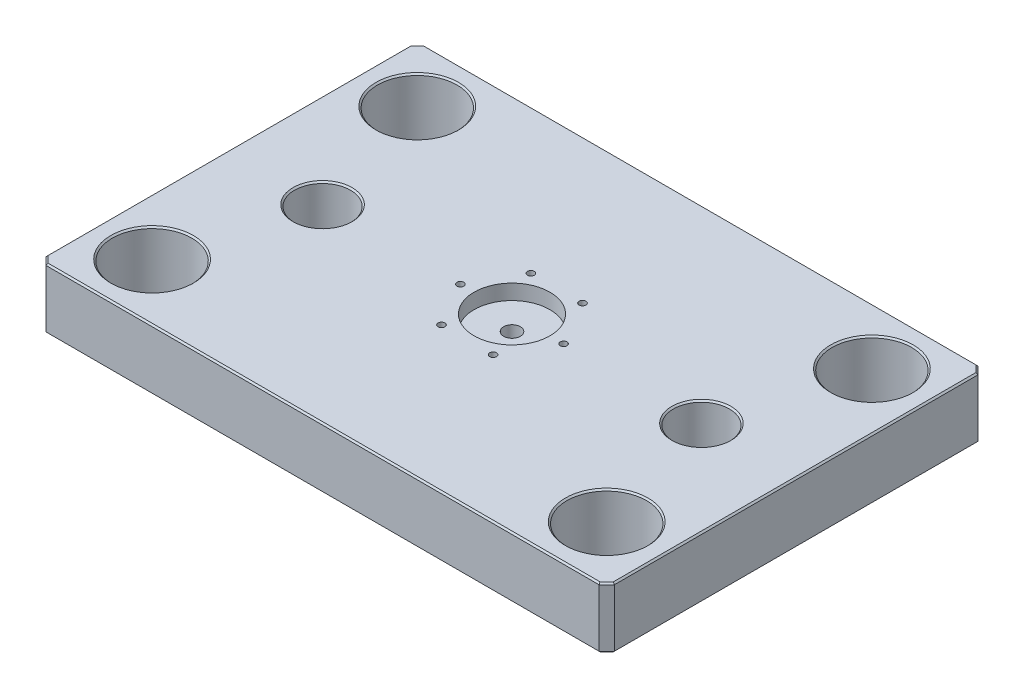
from build123d import *

# Parameters (mm, degrees)
SZKIC1_W                                            = 750
SZKIC1_H                                            = 500
WYCI_GNI_CIE1_DEPTH                                 = 80
SFAZOWANIE1_SIZE                                    = 10
WYCI_GNI_CIE2_REACH                                 = 459.739
SZKIC2_R                                            = 52.5
WYCI_GNI_CIE3_REACH                                 = 459.739
SZKIC3_R                                            = 37
SFAZOWANIE2_SIZE                                    = 2
WYTNIJ_WYCI_GNI_CIE1_DEPTH                          = 0.1
SZKIC5_R                                            = 50
WYTNIJ_WYCI_GNI_CIE3_DEPTH                          = 20
POG_BIENIE_WALCOWE_POD_M8_WKR_T_Z_BEM_W_D           = 9
POG_BIENIE_WALCOWE_POD_M8_WKR_T_Z_BEM_W_CBORE_D     = 15
POG_BIENIE_WALCOWE_POD_M8_WKR_T_Z_BEM_W_CBORE_DEPTH = 8.6
OTW_R_POD_RUB_M201_D                                = 22


with BuildPart() as part:
    # Szkic1 → Wyciągnięcie1 (new body)
    with BuildSketch(Plane(origin=(0, 0, 0), x_dir=(1, 0, 0), z_dir=(0, 1, 0))):
        Rectangle(SZKIC1_W, SZKIC1_H)
    extrude(amount=WYCI_GNI_CIE1_DEPTH)

    # Sfazowanie1
    sfazowanie1_edges = [part.edges().sort_by_distance(p)[0] for p in [
        (375, 40, 250),
        (-375, 40, 250),
        (-375, 40, -250),
        (375, 40, -250),
    ]]
    chamfer(sfazowanie1_edges, length=SFAZOWANIE1_SIZE)

    # Szkic2 → Wyciągnięcie2 (cut, up to next)
    with BuildSketch(Plane(origin=(0, 80, 0), x_dir=(1, 0, 0), z_dir=(0, 1, 0)), mode=Mode.PRIVATE) as wyci_gni_cie2_sk1:
        with Locations(Location((-300, 175, 0), (0, 0, 270))):
            Circle(SZKIC2_R)
    wyci_gni_cie2_tool1 = extrude(wyci_gni_cie2_sk1.sketch, amount=-WYCI_GNI_CIE2_REACH, mode=Mode.PRIVATE) & part.part
    # Szkic2 → Wyciągnięcie2 (cut, up to next)
    with BuildSketch(Plane(origin=(0, 80, 0), x_dir=(1, 0, 0), z_dir=(0, 1, 0)), mode=Mode.PRIVATE) as wyci_gni_cie2_sk2:
        with Locations(Location((300, 175, 0), (0, 0, 90))):
            Circle(SZKIC2_R)
    wyci_gni_cie2_tool2 = extrude(wyci_gni_cie2_sk2.sketch, amount=-WYCI_GNI_CIE2_REACH, mode=Mode.PRIVATE) & part.part
    # Szkic2 → Wyciągnięcie2 (cut, up to next)
    with BuildSketch(Plane(origin=(0, 80, 0), x_dir=(1, 0, 0), z_dir=(0, 1, 0)), mode=Mode.PRIVATE) as wyci_gni_cie2_sk3:
        with Locations(Location((-300, -175, 0), (0, 0, 90))):
            Circle(SZKIC2_R)
    wyci_gni_cie2_tool3 = extrude(wyci_gni_cie2_sk3.sketch, amount=-WYCI_GNI_CIE2_REACH, mode=Mode.PRIVATE) & part.part
    # Szkic2 → Wyciągnięcie2 (cut, up to next)
    with BuildSketch(Plane(origin=(0, 80, 0), x_dir=(1, 0, 0), z_dir=(0, 1, 0)), mode=Mode.PRIVATE) as wyci_gni_cie2_sk4:
        with Locations(Location((300, -175, 0), (0, 0, 270))):
            Circle(SZKIC2_R)
    wyci_gni_cie2_tool4 = extrude(wyci_gni_cie2_sk4.sketch, amount=-WYCI_GNI_CIE2_REACH, mode=Mode.PRIVATE) & part.part
    add(wyci_gni_cie2_tool1.solids().sort_by_distance((-300, 80, -175))[0], mode=Mode.SUBTRACT)
    add(wyci_gni_cie2_tool2.solids().sort_by_distance((300, 80, -175))[0], mode=Mode.SUBTRACT)
    add(wyci_gni_cie2_tool3.solids().sort_by_distance((-300, 80, 175))[0], mode=Mode.SUBTRACT)
    add(wyci_gni_cie2_tool4.solids().sort_by_distance((300, 80, 175))[0], mode=Mode.SUBTRACT)

    # Szkic3 → Wyciągnięcie3 (cut, up to next)
    with BuildSketch(Plane(origin=(0, 80, 0), x_dir=(1, 0, 0), z_dir=(0, 1, 0)), mode=Mode.PRIVATE) as wyci_gni_cie3_sk1:
        with Locations(Location((-250, 0, 0), (0, 0, 270))):
            Circle(SZKIC3_R)
    wyci_gni_cie3_tool1 = extrude(wyci_gni_cie3_sk1.sketch, amount=-WYCI_GNI_CIE3_REACH, mode=Mode.PRIVATE) & part.part
    # Szkic3 → Wyciągnięcie3 (cut, up to next)
    with BuildSketch(Plane(origin=(0, 80, 0), x_dir=(1, 0, 0), z_dir=(0, 1, 0)), mode=Mode.PRIVATE) as wyci_gni_cie3_sk2:
        with Locations(Location((250, 0, 0), (0, 0, 90))):
            Circle(SZKIC3_R)
    wyci_gni_cie3_tool2 = extrude(wyci_gni_cie3_sk2.sketch, amount=-WYCI_GNI_CIE3_REACH, mode=Mode.PRIVATE) & part.part
    add(wyci_gni_cie3_tool1.solids().sort_by_distance((-250, 80, 0))[0], mode=Mode.SUBTRACT)
    add(wyci_gni_cie3_tool2.solids().sort_by_distance((250, 80, 0))[0], mode=Mode.SUBTRACT)

    # Sfazowanie2
    sfazowanie2_edges = [part.edges().sort_by_distance(p)[0] for p in [
        (375, 0, 0),
        (375, 80, 0),
        (0, 0, 250),
        (-375, 0, 0),
        (0, 0, -250),
        (-370, 0, 245),
        (-370, 0, -245),
        (370, 0, -245),
        (370, 0, 245),
        (0, 80, 250),
        (0, 80, -250),
        (-375, 80, 0),
        (-370, 80, 245),
        (-370, 80, -245),
        (370, 80, -245),
        (370, 80, 245),
        (-300, 0, -227.5),
        (-300, 80, -227.5),
        (300, 0, -122.5),
        (300, 80, -122.5),
        (-300, 0, 227.5),
        (-300, 80, 227.5),
        (300, 0, 122.5),
        (300, 80, 122.5),
        (-250, 0, -37),
        (-250, 80, -37),
        (250, 0, 37),
        (250, 80, 37),
    ]]
    chamfer(sfazowanie2_edges, length=SFAZOWANIE2_SIZE)

    # Szkic4 → Wytnij-wyciągnięcie1 (cut)
    with BuildSketch(Plane(origin=(0, 0, -250), x_dir=(-1, 0, 0), z_dir=(0, 0, -1))):
        Polygon((-363.299129796, 74.48655724), (-362.394621346, 76.295574139), (-361.625789164, 76.295574139), (-361.625789164, 72.270511538), (-362.394621346, 72.270511538), (-362.394621346, 74.283042838), align=None)
        Polygon((-358.2791079, 76.295574139), (-359.952448532, 73.808175902), (-358.2791079, 73.808175902), (-358.2791079, 72.270511538), (-357.666731233, 72.270511538), (-357.666731233, 76.295574139), align=None)
    extrude(amount=-WYTNIJ_WYCI_GNI_CIE1_DEPTH, mode=Mode.SUBTRACT)

    # Szkic5 → Wytnij-wyciągnięcie3 (cut)
    with BuildSketch(Plane(origin=(0, 80, 0), x_dir=(-1, 0, 0), z_dir=(0, -1, 0))):
        with Locations(Location((0, 0, 0), (0, 0, 90))):
            Circle(SZKIC5_R)
    extrude(amount=WYTNIJ_WYCI_GNI_CIE3_DEPTH, mode=Mode.SUBTRACT)

    # Pogłębienie walcowe pod M8 Wkręt z łbem walcowym z gniazdem sześciokątnym1 (through all)
    with Locations(Plane(origin=(-68.13672833, 0, 0), x_dir=(0, 0, -1), z_dir=(0, -1, 0))):
        with Locations((0, 0), (-59.008137665, 34.068364165), (-59.008137665, 102.205092495), (0, 136.27345666), (59.008137665, 102.205092495), (59.008137665, 34.068364165)):
            CounterBoreHole(POG_BIENIE_WALCOWE_POD_M8_WKR_T_Z_BEM_W_D / 2, POG_BIENIE_WALCOWE_POD_M8_WKR_T_Z_BEM_W_CBORE_D / 2, POG_BIENIE_WALCOWE_POD_M8_WKR_T_Z_BEM_W_CBORE_DEPTH)

    # Otwór pod śrubę M201 (through all)
    with Locations(Plane(origin=(0, 0, 0), x_dir=(-1, 0, 0), z_dir=(0, -1, 0))):
        with Locations((0, 0)):
            Hole(OTW_R_POD_RUB_M201_D / 2)


solid = part.part
